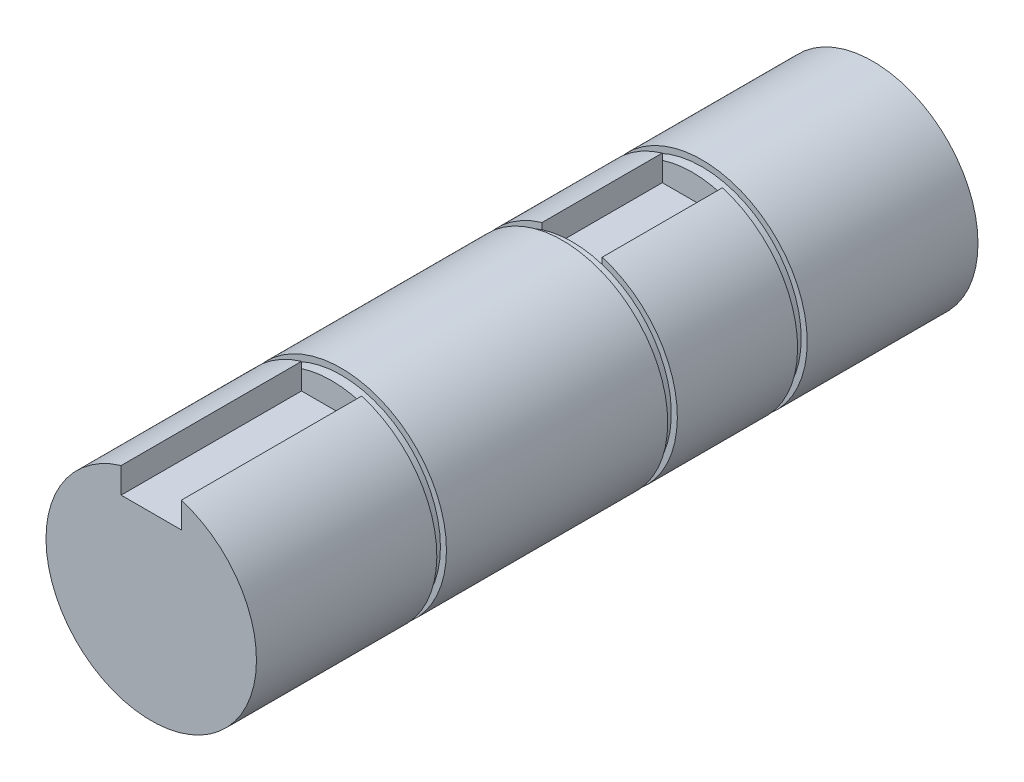
from build123d import *

# Parameters (mm, degrees)
SKETCH1_R           = 17.5
BOSS_EXTRUDE1_DEPTH = 120
CUT_EXTRUDE1_START  = 30
CUT_EXTRUDE1_DEPTH  = 20
CUT_EXTRUDE2_START  = 90
CUT_EXTRUDE2_DEPTH  = 30
SKETCH3_W           = 1.6
SKETCH3_H           = 1


with BuildPart() as part:
    # Sketch1 → Boss-Extrude1 (new body)
    with BuildSketch(Plane.XY):
        Circle(SKETCH1_R)
    extrude(amount=BOSS_EXTRUDE1_DEPTH)

    # Sketch2 → Cut-Extrude1 (cut)
    with BuildSketch(Plane.XY.offset(CUT_EXTRUDE1_START)):
        with BuildLine():
            Line((-5, 16.770509831), (-5, 12.5))
            Line((-5, 12.5), (5, 12.5))
            Line((5, 12.5), (5, 16.770509831))
            ThreePointArc((5, 16.770509831), (0, 17.5), (-5, 16.770509831))
        make_face()
    extrude(amount=CUT_EXTRUDE1_DEPTH, mode=Mode.SUBTRACT)

    # Sketch2<2> → Cut-Extrude2 (cut)
    with BuildSketch(Plane.XY.offset(CUT_EXTRUDE2_START)):
        with BuildLine():
            Line((-5, 16.770509831), (-5, 12.5))
            Line((-5, 12.5), (5, 12.5))
            Line((5, 12.5), (5, 16.770509831))
            ThreePointArc((5, 16.770509831), (0, 17.5), (-5, 16.770509831))
        make_face()
    extrude(amount=CUT_EXTRUDE2_DEPTH, mode=Mode.SUBTRACT)

    # Sketch3 → Cut-Revolve2 (revolve, cut)
    with BuildSketch(Plane(origin=(0, 0, 0), x_dir=(0, 0, -1), z_dir=(1, 0, 0))):
        with Locations((-29.2, 17)):
            Rectangle(SKETCH3_W, SKETCH3_H)
        with Locations((-50.8, 17)):
            Rectangle(SKETCH3_W, SKETCH3_H)
        with Locations((-89.2, 17)):
            Rectangle(SKETCH3_W, SKETCH3_H)
    revolve(axis=Axis((0, 0, 0), (0, 0, 1)), mode=Mode.SUBTRACT)


solid = part.part
